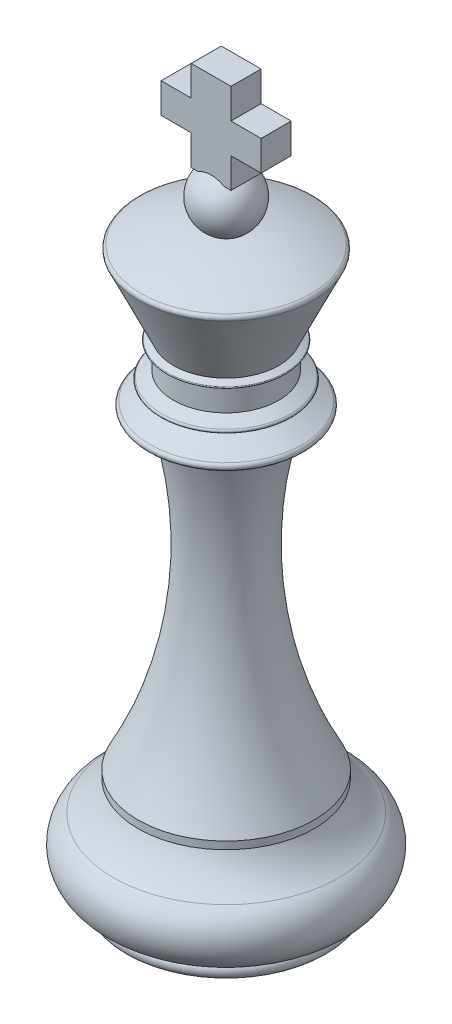
from build123d import *

# Parameters (mm, degrees)
BOSS_EXTRUDE2_DEPTH = 2


with BuildPart() as part:
    # Sketch1 → Revolve1 (revolve)
    with BuildSketch(Plane.XY, mode=Mode.PRIVATE) as revolve1_sk:
        with BuildLine():
            Line((7, 55), (10.105572809, 56.552786405))
            ThreePointArc((10.105572809, 56.552786405), (10.381966011, 57), (10.105572809, 57.447213595))
            Line((10.105572809, 57.447213595), (7, 59))
            Line((7, 59), (8.552786405, 59.776393202))
            ThreePointArc((8.552786405, 59.776393202), (8.690983006, 60), (8.552786405, 60.223606798))
            Line((8.552786405, 60.223606798), (7, 61))
            Line((7, 61), (7, 64))
            Line((7, 64), (7.821114562, 64.410557281))
            ThreePointArc((7.821114562, 64.410557281), (7.876393202, 64.5), (7.821114562, 64.589442719))
            Line((7.821114562, 64.589442719), (7, 65))
            Line((7, 65), (11.563798224, 74.787096875))
            ThreePointArc((11.563798224, 74.787096875), (11.578998901, 75.173460273), (11.314109053, 75.455135802))
            ThreePointArc((11.314109053, 75.455135802), (6.976689102, 76.994339984), (2.452650205, 77.840172953))
            ThreePointArc((2.452650205, 77.840172953), (3.784131881, 82.296281569), (0, 85))
            Line((0, 85), (0, 0))
            Line((0, 0), (12.5, 0))
            ThreePointArc((12.5, 0), (13.5, 1), (12.5, 2))
            ThreePointArc((12.5, 2), (16.690763654, 5.081011358), (15, 10))
            ThreePointArc((15, 10), (13.07530696, 11.771128572), (11.706558674, 14))
            Line((11.706558674, 14), (11.706558674, 15))
            ThreePointArc((11.706558674, 15), (5.560127504, 34.553682708), (7, 55))
        make_face()
    revolve(revolve1_sk.sketch.rotate(Axis((0, 91.159850476, 0), (0, -1, 0)), 90), axis=Axis((0, 91.159850476, 0), (0, -1, 0)))

    # Sketch3 → Boss-Extrude2 (add, symmetric)
    with BuildSketch(Plane.XY):
        Polygon((-2.646, 84), (2.646, 84), (2.646, 88), (6.646, 88), (6.646, 92), (2.646, 92), (2.646, 96), (-2.646, 96), (-2.646, 92), (-6.646, 92), (-6.646, 88), (-2.646, 88), align=None)
    extrude(amount=BOSS_EXTRUDE2_DEPTH, both=True)


solid = part.part
